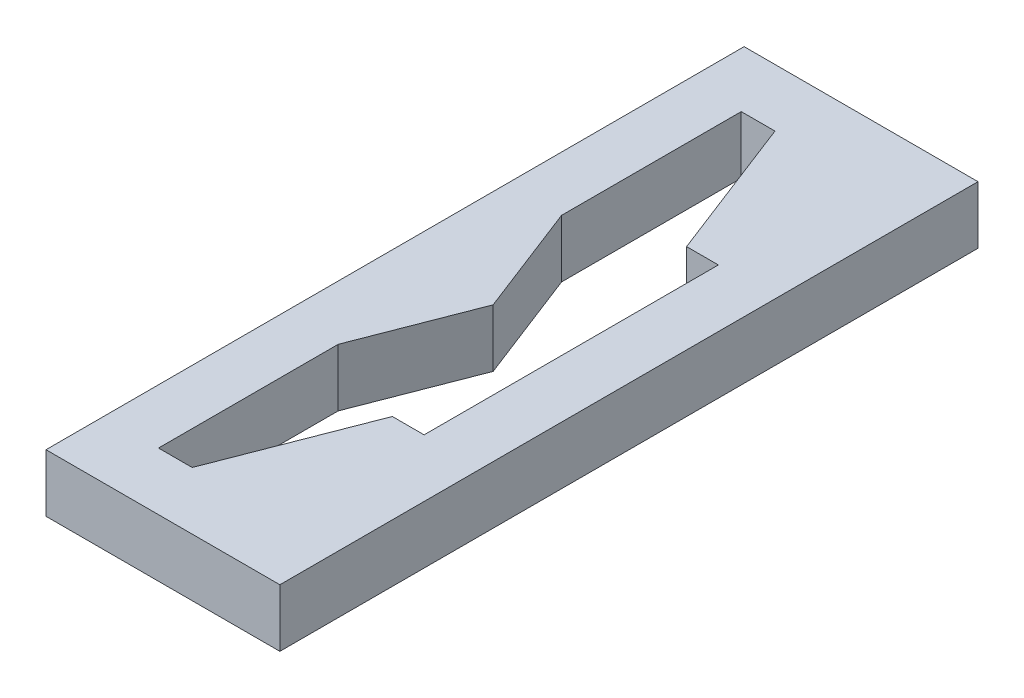
from build123d import *

# Parameters (mm, degrees)
SKETCH_5_W      = 8.106936937
SKETCH_5_H      = 24.2
EXTRUDE_3_DEPTH = 2


with BuildPart() as part:
    # 스케치5 → 보스-돌출3 (new body)
    with BuildSketch(Plane(origin=(0, 0, 0), x_dir=(1, 0, 0), z_dir=(0, 1, 0))):
        with Locations((2.053468469, -10)):
            Rectangle(SKETCH_5_W, SKETCH_5_H)
        Polygon((-0.1, -13.871307421), (1.399695667, -10), (-0.1, -6.128692579), (-0.1, 0.1), (1.068502531, 0.1), (3.005439468, -4.9), (4.106936937, -4.9), (4.106936937, -15.1), (3.005439468, -15.1), (1.068502531, -20.1), (-0.1, -20.1), align=None, mode=Mode.SUBTRACT)
    extrude(amount=EXTRUDE_3_DEPTH)


solid = part.part
